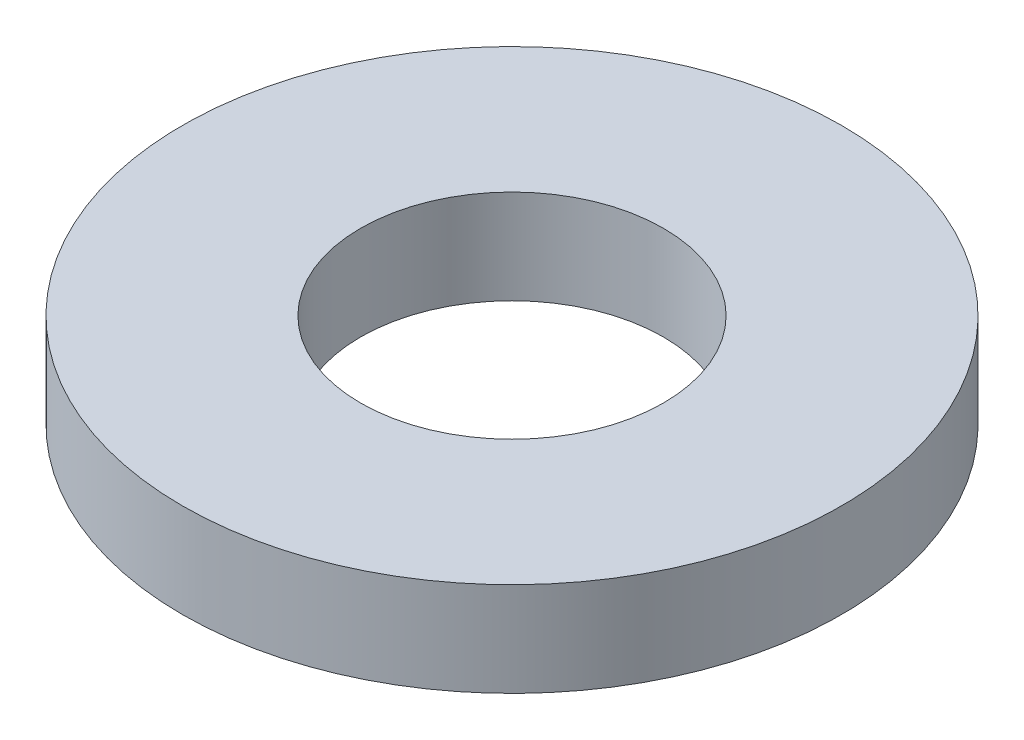
from build123d import *

# Parameters (mm, degrees)
SKETCH1_R           = 5.55625
SKETCH1_R_2         = 2.5527
BOSS_EXTRUDE1_DEPTH = 1.5875


with BuildPart() as part:
    # Sketch1 → Boss-Extrude1 (new body)
    with BuildSketch(Plane(origin=(0, 0, 0), x_dir=(1, 0, 0), z_dir=(0, 1, 0))):
        with Locations(Location((0, 0, 0), (0, 0, 270))):
            Circle(SKETCH1_R)
        with Locations(Location((0, 0, 0), (0, 0, 270))):
            Circle(SKETCH1_R_2, mode=Mode.SUBTRACT)
    extrude(amount=BOSS_EXTRUDE1_DEPTH)


solid = part.part
